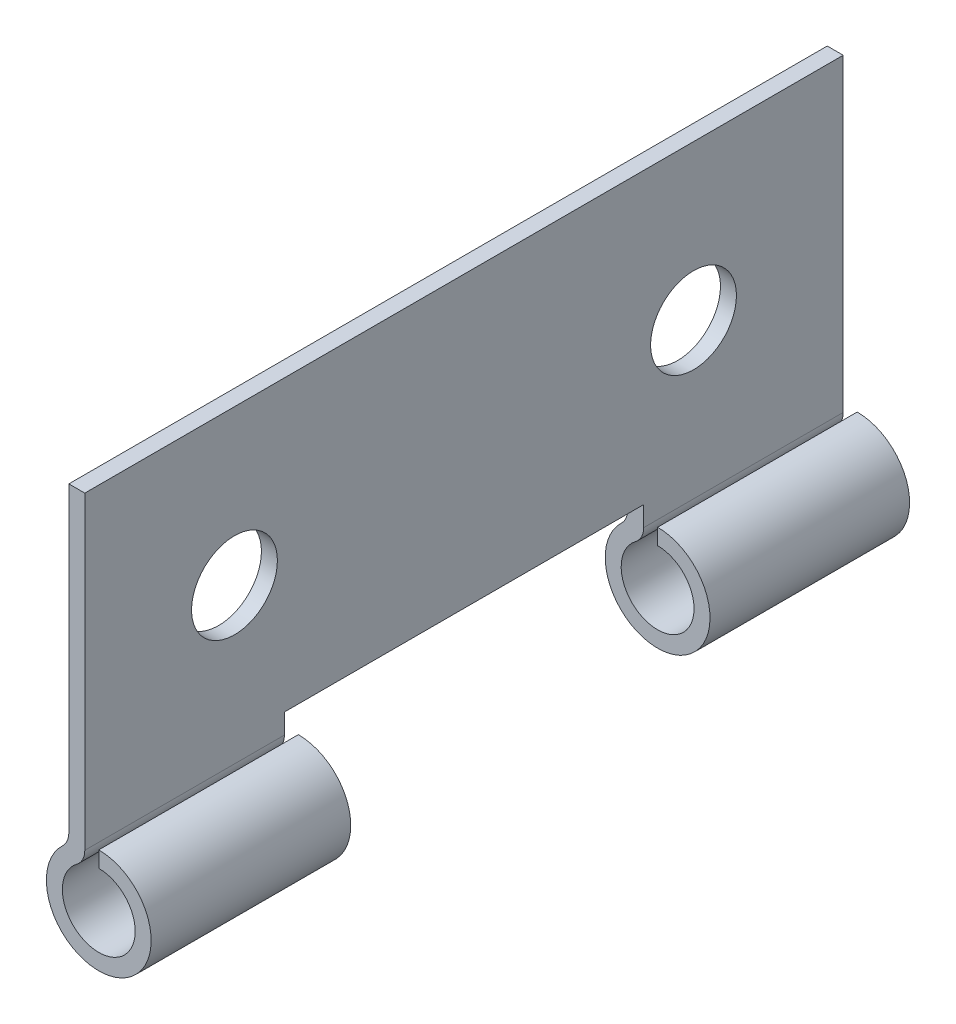
from build123d import *

# Parameters (mm, degrees)
BOSS_EXTRUDE1_DEPTH     = 38
CUT_EXTRUDE1_REACH      = 43.037
SKETCH2_R               = 2.15
CUT_EXTRUDE4_DEPTH      = 42.036691991
CUT_EXTRUDE4_DEPTH_BACK = 42.036691991
SKETCH3_W               = 18
SKETCH3_H               = 1
SKETCH3_H_2             = 4.881241343


with BuildPart() as part:
    # Sketch1 → Boss-Extrude1 (new body)
    with BuildSketch(Plane.XY):
        with BuildLine():
            Line((0.8, -0.368758657), (0.8, 15.131241343))
            Line((0.8, 15.131241343), (0, 15.131241343))
            Line((0, 15.131241343), (0, 0))
            ThreePointArc((0, 0), (-0.08085497, -0.393919299), (-0.310344828, -0.724137931))
            ThreePointArc((-0.310344828, -0.724137931), (2.474900525, -5.062251314), (1.5, 0))
            Line((1.5, 0), (1.5, -0.8))
            ThreePointArc((1.5, -0.8), (2.079032119, -4.355707025), (0.401769912, -1.167428159))
            ThreePointArc((0.401769912, -1.167428159), (0.69492176, -0.814981745), (0.8, -0.368758657))
        make_face()
    extrude(amount=BOSS_EXTRUDE1_DEPTH)

    # Sketch2 → Cut-Extrude1 (cut, up to next)
    with BuildSketch(Plane(origin=(0.8, 0, 0), x_dir=(0, 0, -1), z_dir=(1, 0, 0)), mode=Mode.PRIVATE) as cut_extrude1_sk1:
        with Locations((-30.5, 7.381241343)):
            Circle(SKETCH2_R)
    cut_extrude1_tool1 = extrude(cut_extrude1_sk1.sketch, amount=-CUT_EXTRUDE1_REACH, mode=Mode.PRIVATE) & part.part
    # Sketch2 → Cut-Extrude1 (cut, up to next)
    with BuildSketch(Plane(origin=(0.8, 0, 0), x_dir=(0, 0, -1), z_dir=(1, 0, 0)), mode=Mode.PRIVATE) as cut_extrude1_sk2:
        with Locations((-7.5, 7.381241343)):
            Circle(SKETCH2_R)
    cut_extrude1_tool2 = extrude(cut_extrude1_sk2.sketch, amount=-CUT_EXTRUDE1_REACH, mode=Mode.PRIVATE) & part.part
    add(cut_extrude1_tool1.solids().sort_by_distance((0.8, 7.381241, 30.5))[0], mode=Mode.SUBTRACT)
    add(cut_extrude1_tool2.solids().sort_by_distance((0.8, 7.381241, 7.5))[0], mode=Mode.SUBTRACT)

    # Sketch3 → Cut-Extrude4 (cut, two sides: drawn at the far end of the back side and taken through both)
    with BuildSketch(Plane(origin=(0.8, 0, 0), x_dir=(0, 0, -1), z_dir=(1, 0, 0)).offset(-CUT_EXTRUDE4_DEPTH_BACK)):
        with Locations((-19, 0.131241343)):
            Rectangle(SKETCH3_W, SKETCH3_H)
        with Locations((-19, -2.809379328)):
            Rectangle(SKETCH3_W, SKETCH3_H_2)
    extrude(amount=CUT_EXTRUDE4_DEPTH + CUT_EXTRUDE4_DEPTH_BACK, mode=Mode.SUBTRACT)


solid = part.part
